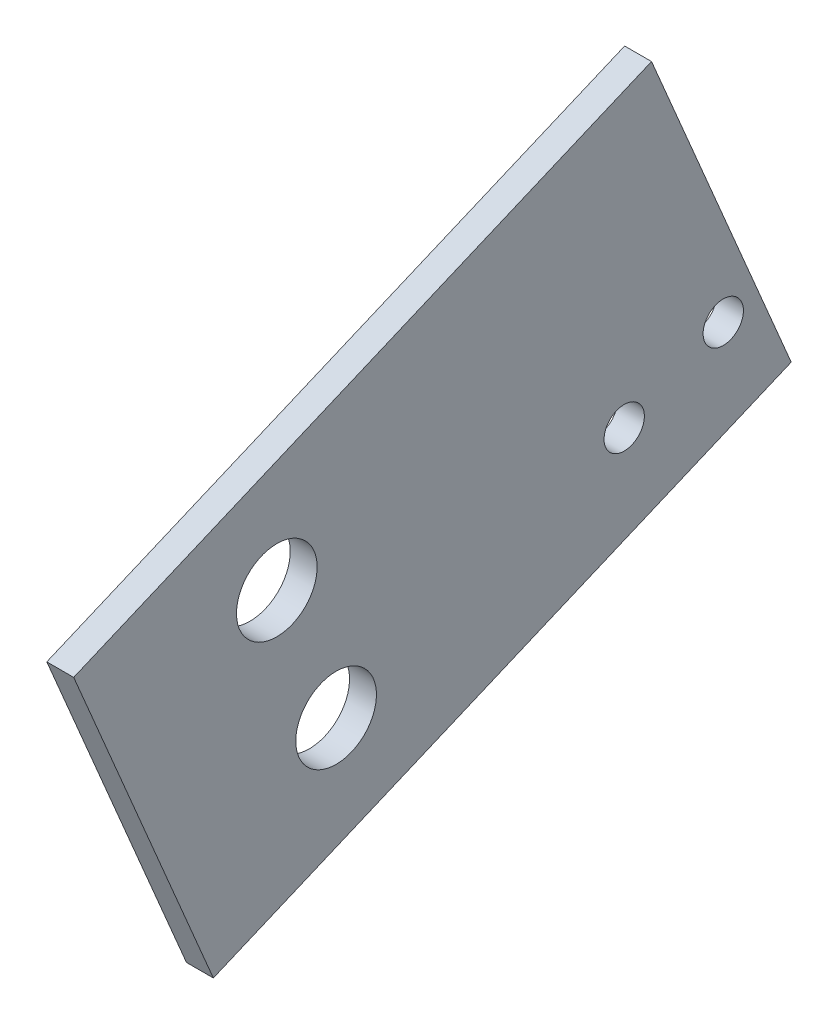
from build123d import *

# Parameters (mm, degrees)
BOSS_EXTRUDE1_DEPTH           = 30.262794
BOSS_EXTRUDE1_DEPTH_BACK      = 39.74
SKETCH1_W                     = 3
SKETCH1_H                     = 40
SKETCH2_R                     = 4.5
M8_CLEARANCE_9MM_THRU_DEPTH   = 251.318329136
SKETCH3_R                     = 2.25
M4_CLEARANCE_4_5MM_THRU_DEPTH = 251.318329136


with BuildPart() as part:
    # Sketch1 → Boss-Extrude1 (new, two sides: drawn at the far end of the back side and taken through both)
    with BuildSketch(Plane(origin=(0, 35.78883795, -84.609977663), x_dir=(-1, 0, 0), z_dir=(0, 0.3895689809965895, -0.9209972904657642)).offset(-BOSS_EXTRUDE1_DEPTH_BACK)):
        with Locations((171.999999999, -178.974005291)):
            Rectangle(SKETCH1_W, SKETCH1_H)
    extrude(amount=BOSS_EXTRUDE1_DEPTH + BOSS_EXTRUDE1_DEPTH_BACK)

    # Sketch2 → M8 clearance 9mm-thru (cut, through all)
    with BuildSketch(Plane.ZY.offset(173.499999999)):
        with Locations((-139.220459947, -144.657012833)):
            Circle(SKETCH2_R)
        with Locations((-132.605045493, -129.017218382)):
            Circle(SKETCH2_R)
    extrude(amount=-M8_CLEARANCE_9MM_THRU_DEPTH, mode=Mode.SUBTRACT)

    # Sketch3 → M4 clearance - 4.5mm-thru (cut, through all)
    with BuildSketch(Plane(origin=(-170.499999999, 0, 0), x_dir=(0, 0, -1), z_dir=(1, 0, 0))):
        with Locations((182.416350837, -128.024538833)):
            Circle(SKETCH3_R)
        with Locations((171.364383351, -132.699366605)):
            Circle(SKETCH3_R)
    extrude(amount=-M4_CLEARANCE_4_5MM_THRU_DEPTH, mode=Mode.SUBTRACT)


solid = part.part
